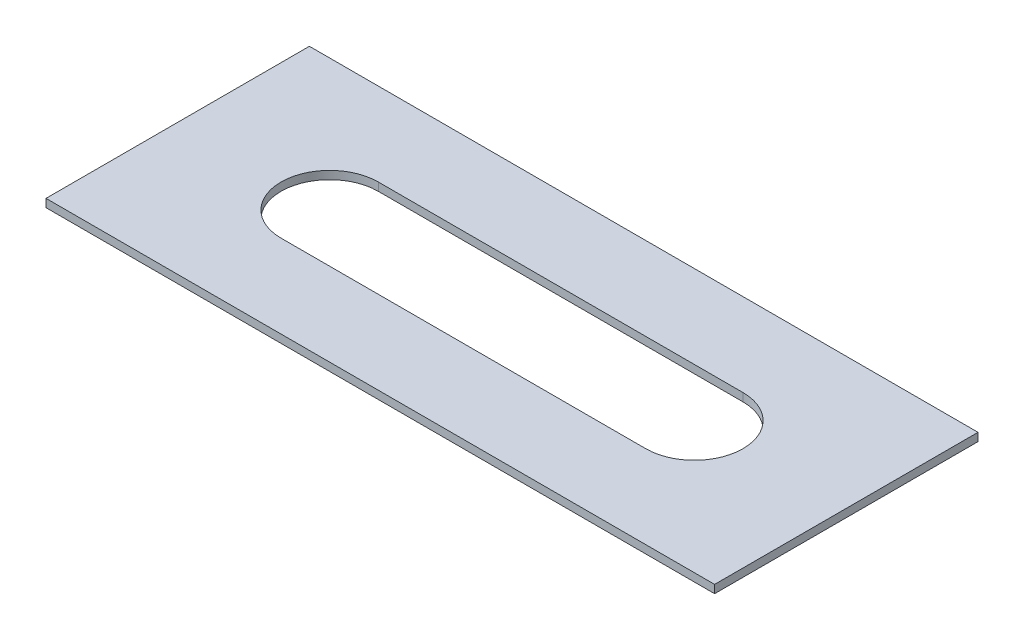
from build123d import *

# Parameters (mm, degrees)
CROQUIS1_W              = 165
CROQUIS1_H              = 65
SALIENTE_EXTRUIR1_DEPTH = 2


with BuildPart() as part:
    # Croquis1 → Saliente-Extruir1 (new body)
    with BuildSketch(Plane(origin=(0, 0, 0), x_dir=(1, 0, 0), z_dir=(0, 1, 0))):
        with Locations((82.5, 32.5)):
            Rectangle(CROQUIS1_W, CROQUIS1_H)
        with BuildLine():
            Line((37.5, 44.5), (127.5, 44.5))
            ThreePointArc((127.5, 44.5), (139.5, 32.5), (127.5, 20.5))
            Line((127.5, 20.5), (37.5, 20.5))
            ThreePointArc((37.5, 20.5), (25.5, 32.5), (37.5, 44.5))
        make_face(mode=Mode.SUBTRACT)
    extrude(amount=SALIENTE_EXTRUIR1_DEPTH)


solid = part.part
